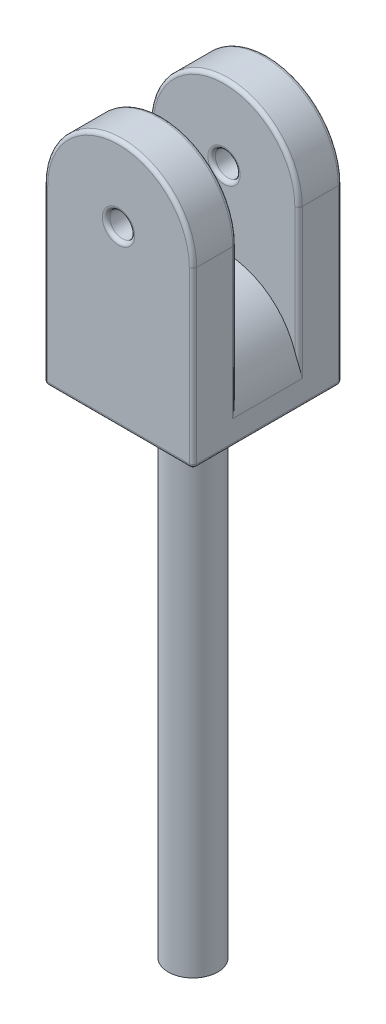
from build123d import *

# Parameters (mm, degrees)
SKETCH1_R           = 12.7
BOSS_EXTRUDE1_DEPTH = 254
SKETCH2_W           = 76.2
SKETCH2_H           = 76.2
BOSS_EXTRUDE2_DEPTH = 127
FILLET1_RADIUS      = 38.1
FILLET1_LENGTH      = 76.2
SKETCH3_W           = 31.75
SKETCH3_H           = 76.2
CUT_EXTRUDE1_DEPTH  = 38.1
HOLE1_REACH         = 392.409
HOLE1_BORE_R        = 6.35
FILLET2_RADIUS      = 38.1
FILLET2_LENGTH      = 31.75
FILLET3_R           = 1.905


with BuildPart() as part:
    # Sketch1 → Boss-Extrude1 (new body)
    with BuildSketch(Plane(origin=(0, 0, 0), x_dir=(1, 0, 0), z_dir=(0, 1, 0))):
        with Locations(Location((0, 0, 0), (0, 0, 270))):
            Circle(SKETCH1_R)
    extrude(amount=BOSS_EXTRUDE1_DEPTH)

    # Sketch2 → Boss-Extrude2 (add)
    with BuildSketch(Plane(origin=(0, 254, 0), x_dir=(1, 0, 0), z_dir=(0, 1, 0))):
        Rectangle(SKETCH2_W, SKETCH2_H)
    extrude(amount=BOSS_EXTRUDE2_DEPTH)

    # Fillet1: full round fillet: the end face becomes a half cylinder, R = half its width
    fillet1_face = Plane((0, 381, 0), x_dir=(0, 0, -1), z_dir=(0, 1, 0))  # on the end face: x along it, z out of the body
    fillet1_slab = fillet1_face.offset(-FILLET1_RADIUS / 2) * Box(FILLET1_LENGTH, 2 * FILLET1_RADIUS, FILLET1_RADIUS, mode=Mode.PRIVATE)  # the body's end, R deep
    fillet1_round = Plane((0, 342.9, 0), x_dir=(0, 1, 0), z_dir=(0, 0, -1)) * Cylinder(FILLET1_RADIUS, FILLET1_LENGTH, mode=Mode.PRIVATE)  # its axis R under the face
    add(fillet1_slab - fillet1_round, mode=Mode.SUBTRACT)

    # Sketch3 → Cut-Extrude1 (cut, symmetric)
    with BuildSketch(Plane(origin=(0, 0, 0), x_dir=(0, 0, -1), z_dir=(1, 0, 0))):
        with Locations((0, 342.9)):
            Rectangle(SKETCH3_W, SKETCH3_H)
    extrude(amount=CUT_EXTRUDE1_DEPTH, both=True, mode=Mode.SUBTRACT)

    # Hole1 bore → Hole1 (cut, up to next)
    with BuildSketch(Plane.XY.offset(38.1), mode=Mode.PRIVATE) as hole1_sk1:
        with Locations((0, 342.9)):
            Circle(HOLE1_BORE_R)
    hole1_tool1 = extrude(hole1_sk1.sketch, amount=-HOLE1_REACH, mode=Mode.PRIVATE) & part.part
    hole1 = hole1_tool1.solids().sort_by_distance((0, 342.9, 38.1))[0]
    add(hole1, mode=Mode.SUBTRACT)

    # Mirror1: Hole1 across plane
    add(hole1.mirror(Plane.XY), mode=Mode.SUBTRACT)

    # Fillet2: full round fillet: the end face becomes a half cylinder, R = half its width
    fillet2_face = Plane((0, 304.8, 0), x_dir=(0, 0, 1), z_dir=(0, 1, 0))  # on the end face: x along it, z out of the body
    fillet2_slab = fillet2_face.offset(-FILLET2_RADIUS / 2) * Box(FILLET2_LENGTH, 2 * FILLET2_RADIUS, FILLET2_RADIUS, mode=Mode.PRIVATE)  # the body's end, R deep
    fillet2_round = Plane((0, 266.7, 0), x_dir=(0, 1, 0), z_dir=(0, 0, 1)) * Cylinder(FILLET2_RADIUS, FILLET2_LENGTH, mode=Mode.PRIVATE)  # its axis R under the face
    add(fillet2_slab - fillet2_round, mode=Mode.SUBTRACT)

    # Fillet3
    fillet3_edges = [part.edges().sort_by_distance(p)[0] for p in [
        (-38.1, 298.45, 38.1),
        (-38.1, 298.45, -38.1),
        (38.1, 298.45, -38.1),
        (38.1, 298.45, 38.1),
        (0, 381, 38.1),
        (0, 381, -38.1),
        (-38.1, 304.8, 15.875),
        (0, 381, 15.875),
        (0, 381, -15.875),
        (-38.1, 304.8, -15.875),
        (38.1, 304.8, 15.875),
        (38.1, 304.8, -15.875),
        (-6.35, 342.9, 38.1),
        (-6.35, 342.9, 15.875),
        (-6.35, 342.9, -38.1),
        (-6.35, 342.9, -15.875),
        (38.1, 254, 0),
        (0, 254, -38.1),
        (-38.1, 254, 0),
        (0, 254, 38.1),
    ]]
    fillet(fillet3_edges, radius=FILLET3_R)


solid = part.part
